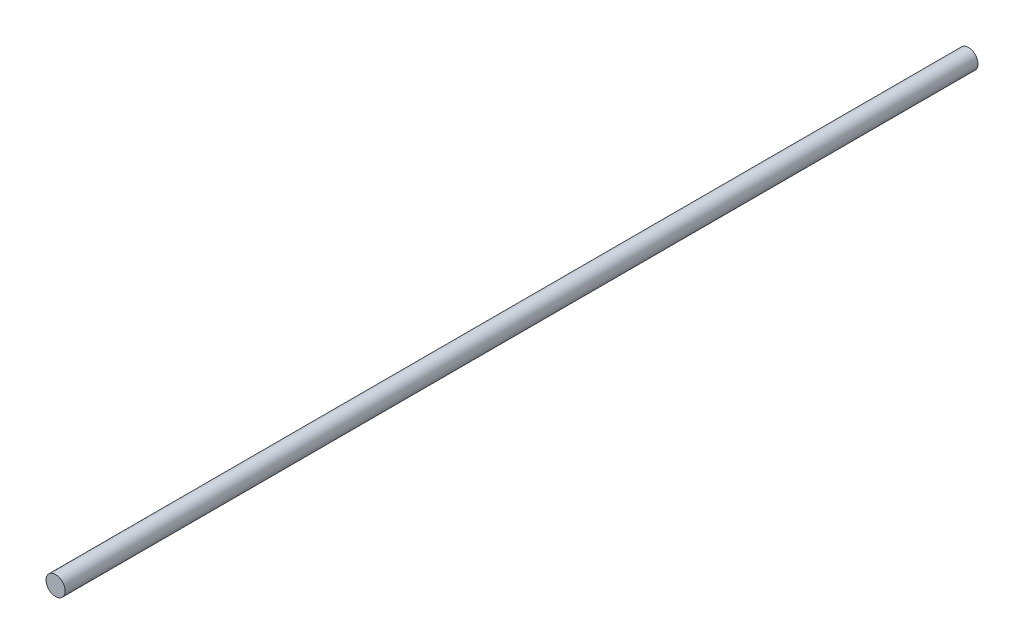
from build123d import *

# Parameters (mm, degrees)
SKETCH1_R           = 0.5
BOSS_EXTRUDE1_DEPTH = 23.876


with BuildPart() as part:
    # Sketch1 → Boss-Extrude1 (new, symmetric)
    with BuildSketch(Plane.XY):
        Circle(SKETCH1_R)
    extrude(amount=BOSS_EXTRUDE1_DEPTH, both=True)


solid = part.part
